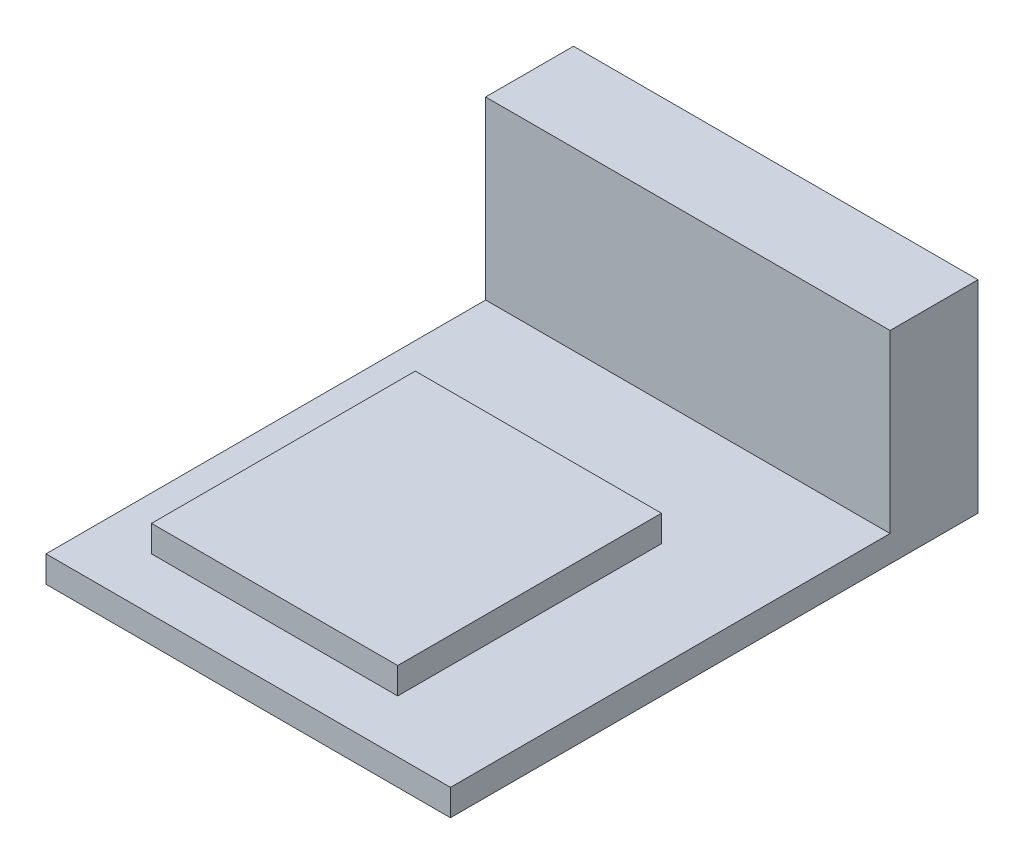
from build123d import *

# Parameters (mm, degrees)
SKETCH_1_W      = 23
SKETCH_1_H      = 30
EXTRUDE_1_DEPTH = 1.5
SKETCH_2_W      = 14
SKETCH_2_H      = 15
EXTRUDE_2_DEPTH = 1.5
SKETCH_3_W      = 23
SKETCH_3_H      = 5
EXTRUDE_3_DEPTH = 10


with BuildPart() as part:
    # Эскиз1 → Бобышка-Вытянуть1 (new body)
    with BuildSketch(Plane(origin=(0, 0, 0), x_dir=(1, 0, 0), z_dir=(0, 1, 0))):
        with Locations((11.5, -15)):
            Rectangle(SKETCH_1_W, SKETCH_1_H)
    extrude(amount=EXTRUDE_1_DEPTH)

    # Эскиз2 → Бобышка-Вытянуть2 (add)
    with BuildSketch(Plane(origin=(0, 1.5, 0), x_dir=(1, 0, 0), z_dir=(0, 1, 0))):
        with Locations((10, -19.5)):
            Rectangle(SKETCH_2_W, SKETCH_2_H)
    extrude(amount=EXTRUDE_2_DEPTH)

    # Эскиз3 → Бобышка-Вытянуть3 (add)
    with BuildSketch(Plane(origin=(0, 1.5, 0), x_dir=(1, 0, 0), z_dir=(0, 1, 0))):
        with Locations((11.5, -2.5)):
            Rectangle(SKETCH_3_W, SKETCH_3_H)
    extrude(amount=EXTRUDE_3_DEPTH)


solid = part.part
